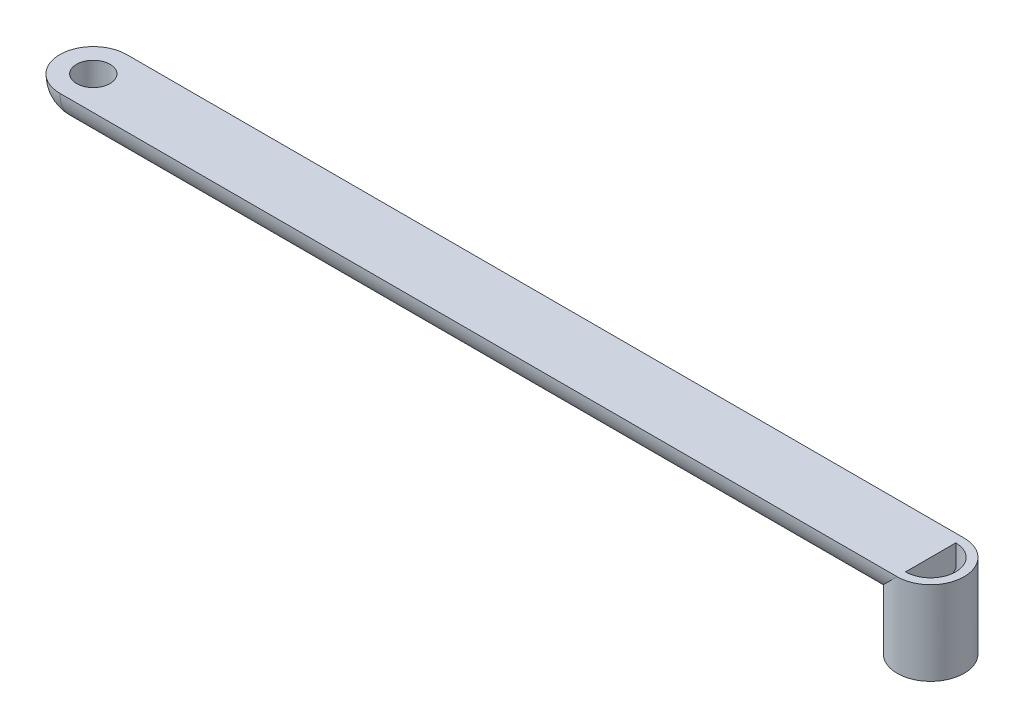
from build123d import *
from build123d.topology import SkipClean

# Parameters (mm, degrees)
REVOLVE_2_ANGLE           = 90
REVOLVE_2_OTHER_WAY_ANGLE = 90
SKETCH_2_R                = 10
CUT_EXTRUDE_1_DEPTH       = 31


with BuildPart() as part:
    # 草图1 → 旋转1 (revolve)
    with BuildSketch(Plane.XY):
        Polygon((15, 30), (15, 0), (20, 0), (20, 50), (15, 50), align=None)
    revolve(axis=Axis((0, 50, 0), (0, -1, 0)))

    # 草图1<3> → 旋转2 (revolve)
    with BuildSketch(Plane.XY):
        with BuildLine():
            Line((0, 30), (0, 50))
            Line((0, 50), (-480, 50))
            ThreePointArc((-480, 50), (-485.857864376, 35.857864376), (-500, 30))
            Line((-500, 30), (0, 30))
        make_face()
    revolve(axis=Axis((0, 50, 0), (-1, 0, 0)), revolution_arc=REVOLVE_2_ANGLE)

    # 草图1<3> → 旋转2 other way (revolve)
    with SkipClean():  # the faces are left unmerged after this step: merging them gives an invalid solid
        with BuildSketch(Plane.XY):
            with BuildLine():
                Line((0, 30), (0, 50))
                Line((0, 50), (-480, 50))
                ThreePointArc((-480, 50), (-485.857864376, 35.857864376), (-500, 30))
                Line((-500, 30), (0, 30))
            make_face()
        revolve(axis=Axis((0, 50, 0), (1, 0, 0)), revolution_arc=REVOLVE_2_OTHER_WAY_ANGLE)

    # 草图1<5> → 旋转4 (revolve)
    with BuildSketch(Plane.XY):
        with BuildLine():
            Line((-500, 50), (-500, 30))
            ThreePointArc((-500, 30), (-485.857864376, 35.857864376), (-480, 50))
            Line((-480, 50), (-500, 50))
        make_face()
    revolve(axis=Axis((-500, 50, 0), (0, -1, 0)))

    # 草图2 → 切除-拉伸1 (cut)
    with BuildSketch(Plane(origin=(0, 50, 0), x_dir=(1, 0, 0), z_dir=(0, 1, 0))):
        with Locations((-500, 0)):
            Circle(SKETCH_2_R)
    extrude(amount=-CUT_EXTRUDE_1_DEPTH, mode=Mode.SUBTRACT)


solid = part.part
